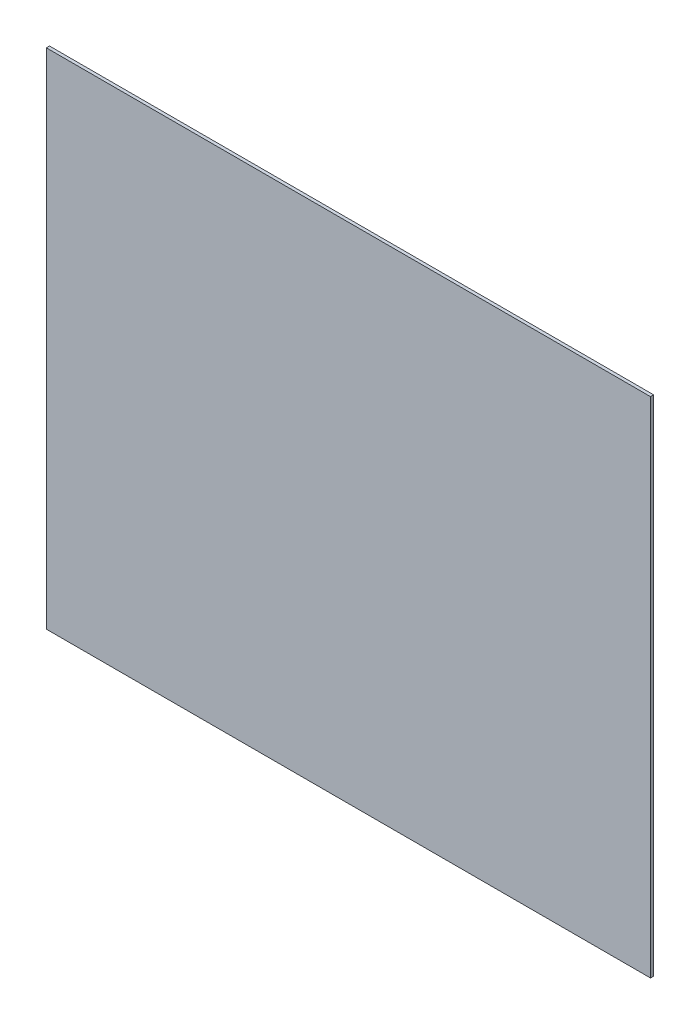
from build123d import *

# Parameters (mm, degrees)
SKETCH1_W           = 609.6
SKETCH1_H           = 508
BOSS_EXTRUDE1_DEPTH = 3.175


with BuildPart() as part:
    # Sketch1 → Boss-Extrude1 (new body)
    with BuildSketch(Plane.XY):
        Rectangle(SKETCH1_W, SKETCH1_H)
    extrude(amount=BOSS_EXTRUDE1_DEPTH)


solid = part.part
